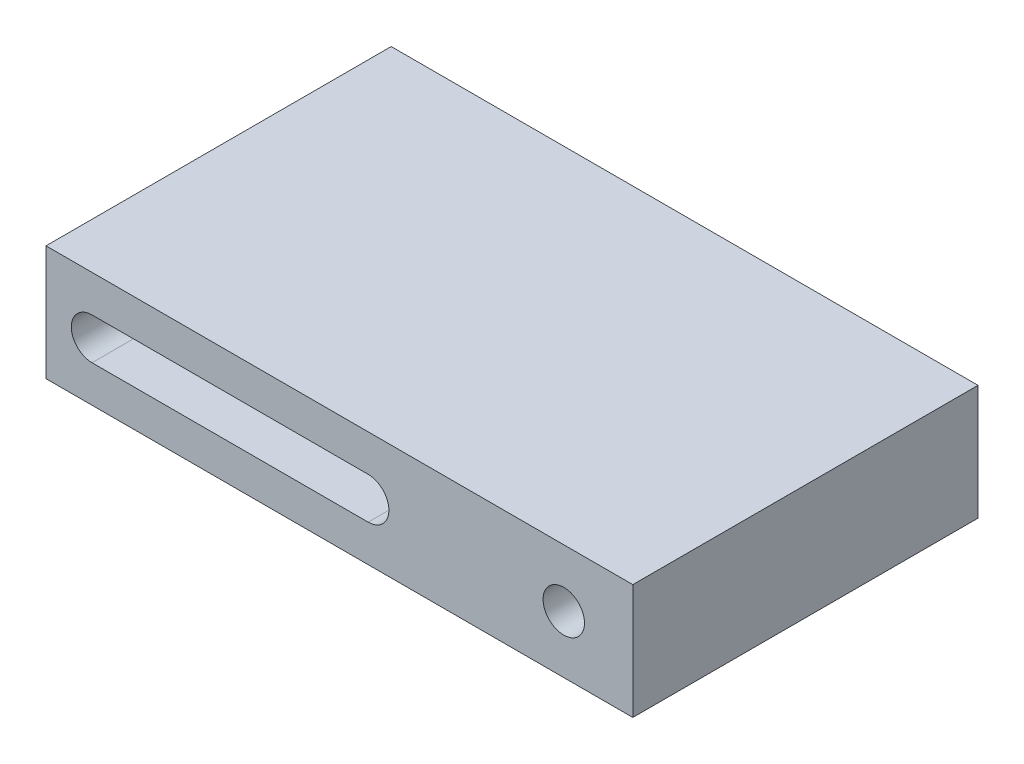
from build123d import *

# Parameters (mm, degrees)
SKETCH1_W           = 2550
SKETCH1_H           = 1500
BOSS_EXTRUDE1_DEPTH = 500
SKETCH2_R           = 90
CUT_EXTRUDE1_DEPTH  = 2032.163459695


with BuildPart() as part:
    # Sketch1 → Boss-Extrude1 (new body)
    with BuildSketch(Plane(origin=(0, 0, 0), x_dir=(1, 0, 0), z_dir=(0, 1, 0))):
        Rectangle(SKETCH1_W, SKETCH1_H)
    extrude(amount=BOSS_EXTRUDE1_DEPTH)

    # Sketch2 → Cut-Extrude1 (cut, through all)
    with BuildSketch(Plane.XY.offset(750)):
        with Locations((975, 250)):
            Circle(SKETCH2_R)
        with BuildLine():
            Line((-1075, 340), (125, 340))
            ThreePointArc((125, 340), (215, 250), (125, 160))
            Line((125, 160), (-1075, 160))
            ThreePointArc((-1075, 160), (-1165, 250), (-1075, 340))
        make_face()
    extrude(amount=-CUT_EXTRUDE1_DEPTH, mode=Mode.SUBTRACT)


solid = part.part
